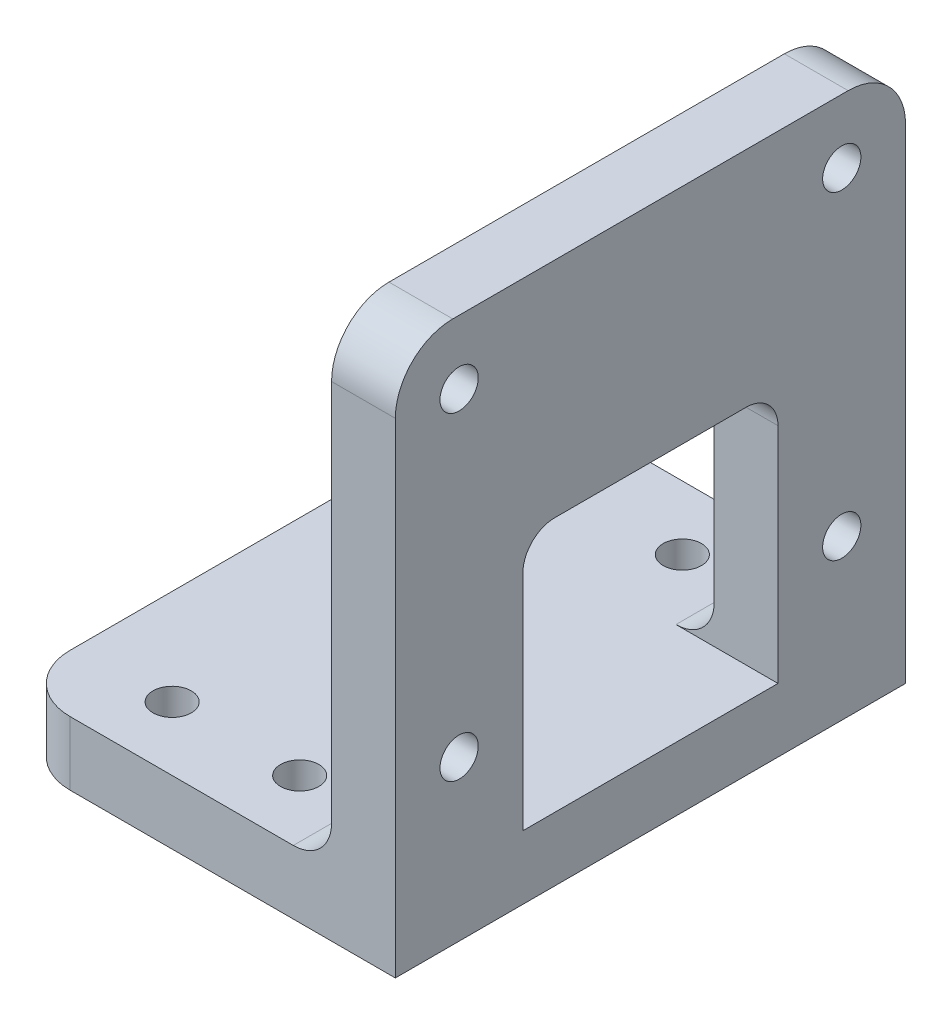
from build123d import *

# Parameters (mm, degrees)
SKETCH1_R           = 1.5
BOSS_EXTRUDE1_DEPTH = 5
SKETCH2_R           = 1.5
BOSS_EXTRUDE3_DEPTH = 5
FILLET4_R           = 3


with BuildPart() as part:
    # Sketch1 → Boss-Extrude1 (new body)
    with BuildSketch(Plane(origin=(0, 0, 0), x_dir=(1, 0, 0), z_dir=(0, 1, 0))):
        with BuildLine():
            Line((4.5, 0), (25, 0))
            Line((25, 0), (25, 40))
            Line((25, 40), (4.5, 40))
            ThreePointArc((4.5, 40), (1.318019485, 38.681980515), (0, 35.5))
            Line((0, 35.5), (0, 4.5))
            ThreePointArc((0, 4.5), (1.318019485, 1.318019485), (4.5, 0))
        make_face()
        with Locations(Location((7.5, 35, 0), (0, 0, 270))):
            Circle(SKETCH1_R, mode=Mode.SUBTRACT)
        with Locations(Location((17.5, 35, 0), (0, 0, 270))):
            Circle(SKETCH1_R, mode=Mode.SUBTRACT)
        with Locations(Location((17.5, 5, 0), (0, 0, 90))):
            Circle(SKETCH1_R, mode=Mode.SUBTRACT)
        with Locations(Location((7.5, 5, 0), (0, 0, 90))):
            Circle(SKETCH1_R, mode=Mode.SUBTRACT)
    extrude(amount=BOSS_EXTRUDE1_DEPTH)

    # Sketch2 → Boss-Extrude3 (add)
    with BuildSketch(Plane(origin=(25, 0, 0), x_dir=(0, 0, -1), z_dir=(1, 0, 0))):
        with BuildLine():
            Line((0, 0), (40, 0))
            Line((40, 0), (40, 38))
            ThreePointArc((40, 38), (38.681980515, 41.181980515), (35.5, 42.5))
            Line((35.5, 42.5), (4.5, 42.5))
            ThreePointArc((4.5, 42.5), (1.318019485, 41.181980515), (0, 38))
            Line((0, 38), (0, 0))
        make_face()
        with Locations((5, 37.5)):
            Circle(SKETCH2_R, mode=Mode.SUBTRACT)
        with Locations((5, 12.5)):
            Circle(SKETCH2_R, mode=Mode.SUBTRACT)
        with Locations(Location((35, 12.5, 0), (0, 0, 180))):
            Circle(SKETCH2_R, mode=Mode.SUBTRACT)
        with Locations(Location((35, 37.5, 0), (0, 0, 180))):
            Circle(SKETCH2_R, mode=Mode.SUBTRACT)
        with BuildLine():
            Line((27.5, 25), (12.5, 25))
            ThreePointArc((12.5, 25), (10.732233047, 24.267766953), (10, 22.5))
            Line((10, 22.5), (10, 5))
            Line((10, 5), (30, 5))
            Line((30, 5), (30, 22.5))
            ThreePointArc((30, 22.5), (29.267766953, 24.267766953), (27.5, 25))
        make_face(mode=Mode.SUBTRACT)
    extrude(amount=BOSS_EXTRUDE3_DEPTH)

    # Fillet4
    fillet4_edges = [part.edges().sort_by_distance(p)[0] for p in [
        (25, 5, -35),
        (25, 5, -5),
    ]]
    fillet(fillet4_edges, radius=FILLET4_R)


solid = part.part
